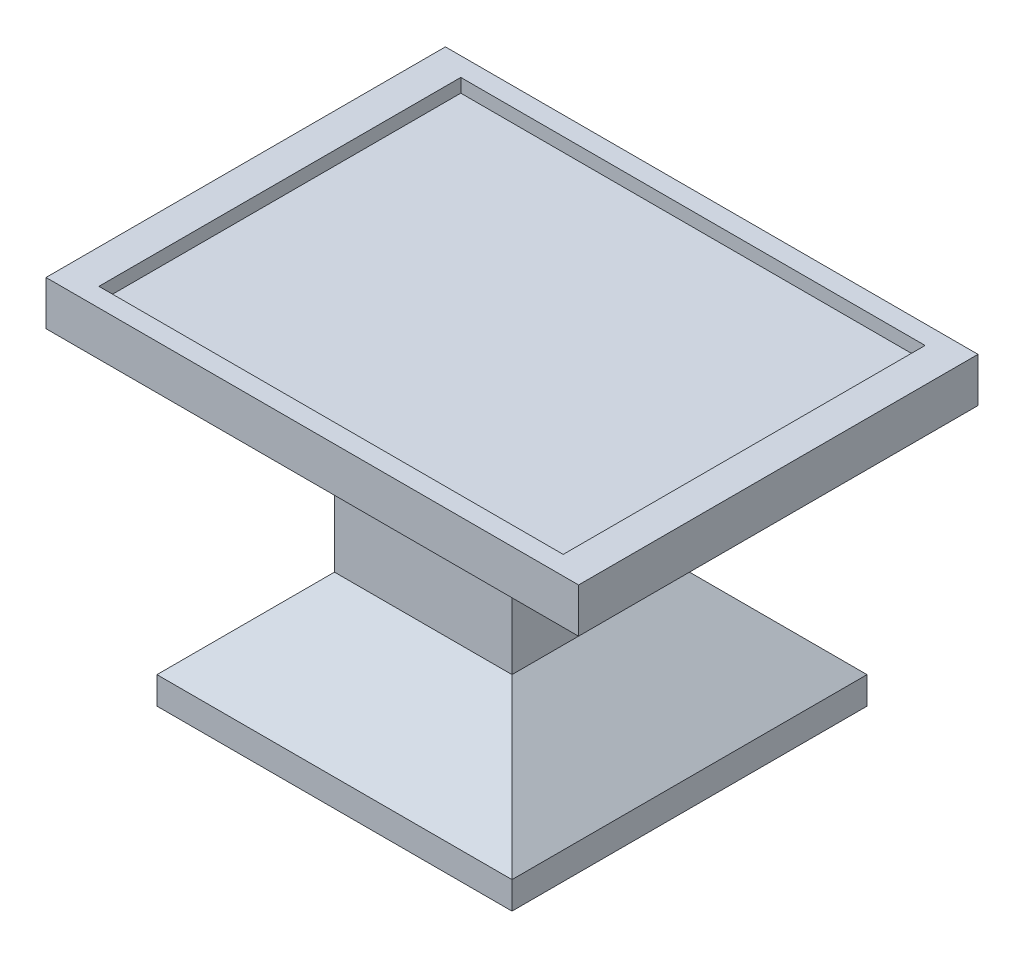
from build123d import *

# Parameters (mm, degrees)
SKETCH1_W           = 39
SKETCH1_H           = 29.25
BOSS_EXTRUDE1_DEPTH = 3.25
SKETCH3_W           = 13
SKETCH3_H           = 13
BOSS_EXTRUDE3_DEPTH = 13
SKETCH5_W           = 34
SKETCH5_H           = 24
CUT_EXTRUDE1_DEPTH  = 1
SKETCH6_W           = 26
SKETCH6_H           = 26
BOSS_EXTRUDE4_DEPTH = 2
SKETCH8_W           = 34
SKETCH8_H           = 1.25
CUT_EXTRUDE2_DEPTH  = 1


with BuildPart() as part:
    # Sketch1 → Boss-Extrude1 (new body)
    with BuildSketch(Plane(origin=(0, 0, 0), x_dir=(1, 0, 0), z_dir=(0, 1, 0))):
        Rectangle(SKETCH1_W, SKETCH1_H)
    extrude(amount=BOSS_EXTRUDE1_DEPTH)

    # Sketch3 → Boss-Extrude3 (add)
    with BuildSketch(Plane.XZ):
        Rectangle(SKETCH3_W, SKETCH3_H)
    extrude(amount=BOSS_EXTRUDE3_DEPTH)

    # Sketch4 → section 0 of loft1
    with BuildSketch(Plane(origin=(0, -19.5, 0), x_dir=(-1, 0, 0), z_dir=(0, -1, 0)), mode=Mode.PRIVATE) as loft1_s0:
        with BuildLine():
            Line((-13, 13), (13, 13))
            Line((13, 13), (13, -13))
            Line((13, -13), (-13, -13))
            Line((-13, -13), (-13, 13))
        make_face()
    # loft up to a face of the part (loft1)
    loft([loft1_s0.sketch, part.faces().sort_by_distance((0, -13, 0))[0]])

    # Sketch5 → Cut-Extrude1 (cut)
    with BuildSketch(Plane(origin=(0, 3.25, 0), x_dir=(1, 0, 0), z_dir=(0, 1, 0))):
        Rectangle(SKETCH5_W, SKETCH5_H)
    extrude(amount=-CUT_EXTRUDE1_DEPTH, mode=Mode.SUBTRACT)

    # Sketch6 → Boss-Extrude4 (add)
    with BuildSketch(Plane.XZ.offset(19.5)):
        Rectangle(SKETCH6_W, SKETCH6_H)
    extrude(amount=BOSS_EXTRUDE4_DEPTH)

    # Sketch8 → Cut-Extrude2 (cut)
    with BuildSketch(Plane(origin=(0, 3.25, 0), x_dir=(1, 0, 0), z_dir=(0, 1, 0))):
        with Locations((0, -12.625)):
            Rectangle(SKETCH8_W, SKETCH8_H)
    cut_extrude2 = extrude(amount=-CUT_EXTRUDE2_DEPTH, mode=Mode.SUBTRACT)

    # Mirror1: Cut-Extrude2 across plane
    add(cut_extrude2.mirror(Plane.XY), mode=Mode.SUBTRACT)


solid = part.part
